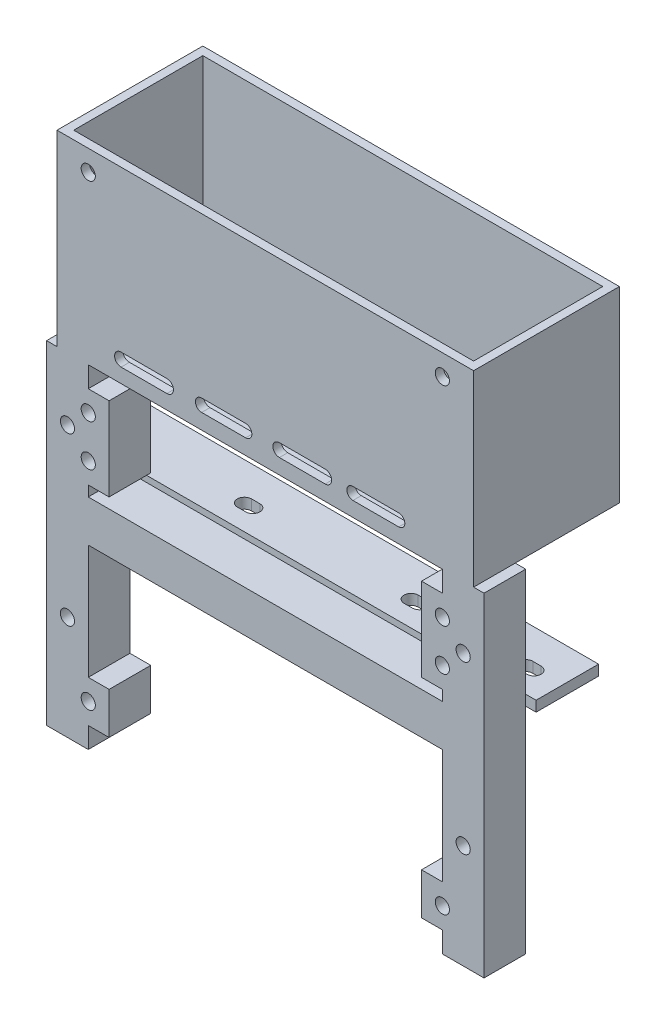
from build123d import *

# Parameters (mm, degrees)
V3_BOX_FOOTPRINT_100_X_45_MM_W                 = 100
V3_BOX_FOOTPRINT_100_X_45_MM_H                 = 45
V3_BOX_HEIGHT_35_MM_DEPTH                      = 35
V3_REAR_OPENING_96_X_31_MM_W                   = 96
V3_REAR_OPENING_96_X_31_MM_H                   = 31
V3_CAVITY_ALL_WALLS_2_MM_DEPTH                 = 43
V3_SQUARE_BEAMS_10_X_10_PITCH_95_MM_W          = 10
V3_SQUARE_BEAMS_10_X_10_PITCH_95_MM_H          = 10
V3_FORWARD_BEAM_LENGTH_65_MM_DEPTH             = 65
V3_LEFT_PCB_EAR_PROFILE_W                      = 10
V3_LEFT_PCB_EAR_PROFILE_H                      = 10
V3_LEFT_INWARD_EAR_5_MM_DEPTH                  = 5
V3_RIGHT_PCB_EAR_PROFILE_W                     = 10
V3_RIGHT_PCB_EAR_PROFILE_H                     = 10
V3_RIGHT_INWARD_EAR_5_MM_DEPTH                 = 5
V3_PCB_ROOF_PAIR_PITCH_85_MM_R                 = 1.7
V3_M3_ROOF_HOLES_DIAMETER_3_4_MM_DEPTH         = 2
V3_PCB_FORWARD_PAIR_ROW_SPACING_60_MM_R        = 1.7
V3_M3_PCB_EAR_HOLES_DEPTH                      = 10
V3_CHASSIS_TOP_HOLES_WIDTH_95_DEPTH_40_M_R     = 1.7
V3_M3_BEAM_TOP_BOTTOM_HOLES_DEPTH              = 10
V3_HANGING_PLATE_OFFSET_26_THICKNESS_2_5_W     = 110
V3_HANGING_PLATE_OFFSET_26_THICKNESS_2_5_H     = 2.5
V3_MOUNTING_PLATE_DOWNWARD_15_MM_WIDTH_1_DEPTH = 15
FOUR_HORIZONTAL_SLOTS_3_4_X_5_4_MM_DEPTH       = 2.5
CUT_EXTRUDE_1_DEPTH                            = 93.059763198
H_CROSSMEMBER_10_X_10_MM_AT_BEAM_MIDPOIN_W     = 10
H_CROSSMEMBER_10_X_10_MM_AT_BEAM_MIDPOIN_H     = 10
H_CROSSMEMBER_85_MM_DEPTH                      = 85
LONGITUDINAL_START                             = -2
BEAM_CAVITIES_6_MM_WIDE_PRESERVING_SCREW_W     = 6
BEAM_CAVITIES_6_MM_WIDE_PRESERVING_SCREW_H     = 6
BEAM_CAVITIES_6_MM_WIDE_PRESERVING_SCREW_H_2   = 27
BEAM_CAVITIES_6_MM_WIDE_PRESERVING_SCREW_H_3   = 9
LONGITUDINAL_BEAM_WALLS_2_MM_INNER_HEI_DEPTH   = 6
H_START                                        = -2
H_CROSSMEMBER_CAVITY_CONNECTS_BOTH_BEAM_W      = 89
H_CROSSMEMBER_CAVITY_CONNECTS_BOTH_BEAM_H      = 6
H_CROSSMEMBER_WALLS_2_MM_DEPTH                 = 6
CUT_EXTRUDE_4_DEPTH                            = 93.059763198
V6_EXTEND_10_X_10_HOLLOW_BEAMS_WITH_2_MM_W     = 10
V6_EXTEND_10_X_10_HOLLOW_BEAMS_WITH_2_MM_H     = 10
V6_EXTEND_10_X_10_HOLLOW_BEAMS_WITH_2_MM_W_2   = 6
V6_EXTEND_10_X_10_HOLLOW_BEAMS_WITH_2_MM_H_2   = 6
V6_HOLLOW_BEAM_EXTENSIONS_15_MM_DEPTH          = 15
V6_FOUR_FULL_DEPTH_PCB_PADS_CENTERS_X42_W      = 15
V6_FOUR_FULL_DEPTH_PCB_PADS_CENTERS_X42_H      = 10
V6_SOLID_SCREW_PADS_WITH_5_MM_INWARD_EAR_DEPTH = 10
V6_PCB_HOLES_85_X_60_MM_AND_RETAINED_CHA_R     = 1.7
V6_FOUR_PCB_M3_HOLES_THROUGH_REINFORCED_DEPTH  = 10


with BuildPart() as part:
    # V3 box footprint 100 x 45 mm → V3 box height 35 mm (new body)
    with BuildSketch(Plane.XY):
        with Locations((0, 22.5)):
            Rectangle(V3_BOX_FOOTPRINT_100_X_45_MM_W, V3_BOX_FOOTPRINT_100_X_45_MM_H)
    extrude(amount=V3_BOX_HEIGHT_35_MM_DEPTH)

    # V3 rear opening 96 x 31 mm → V3 cavity all walls 2 mm (cut)
    with BuildSketch(Plane(origin=(0, 45, 0), x_dir=(1, 0, 0), z_dir=(0, 1, 0))):
        with Locations((0, -17.5)):
            Rectangle(V3_REAR_OPENING_96_X_31_MM_W, V3_REAR_OPENING_96_X_31_MM_H)
    extrude(amount=-V3_CAVITY_ALL_WALLS_2_MM_DEPTH, mode=Mode.SUBTRACT)

    # V3 square beams 10 x 10 pitch 95 mm → V3 forward beam length 65 mm (add)
    with BuildSketch(Plane.XZ):
        with Locations((-47.5, 30)):
            Rectangle(V3_SQUARE_BEAMS_10_X_10_PITCH_95_MM_W, V3_SQUARE_BEAMS_10_X_10_PITCH_95_MM_H)
        with Locations((47.5, 30)):
            Rectangle(V3_SQUARE_BEAMS_10_X_10_PITCH_95_MM_W, V3_SQUARE_BEAMS_10_X_10_PITCH_95_MM_H)
    extrude(amount=V3_FORWARD_BEAM_LENGTH_65_MM_DEPTH)

    # V3 left PCB ear profile → V3 left inward ear 5 mm (add)
    with BuildSketch(Plane(origin=(-42.5, 0, 0), x_dir=(0, 0, -1), z_dir=(1, 0, 0))):
        with Locations((-30, -20)):
            Rectangle(V3_LEFT_PCB_EAR_PROFILE_W, V3_LEFT_PCB_EAR_PROFILE_H)
    extrude(amount=V3_LEFT_INWARD_EAR_5_MM_DEPTH)

    # V3 right PCB ear profile → V3 right inward ear 5 mm (add)
    with BuildSketch(Plane.ZY.offset(-42.5)):
        with Locations((30, -20)):
            Rectangle(V3_RIGHT_PCB_EAR_PROFILE_W, V3_RIGHT_PCB_EAR_PROFILE_H)
    extrude(amount=V3_RIGHT_INWARD_EAR_5_MM_DEPTH)

    # V3 PCB roof pair pitch 85 mm → V3 M3 roof holes diameter 3.4 mm (cut)
    with BuildSketch(Plane.XY.offset(35)):
        with Locations((-42.5, 40)):
            Circle(V3_PCB_ROOF_PAIR_PITCH_85_MM_R)
        with Locations((42.5, 40)):
            Circle(V3_PCB_ROOF_PAIR_PITCH_85_MM_R)
    extrude(amount=-V3_M3_ROOF_HOLES_DIAMETER_3_4_MM_DEPTH, mode=Mode.SUBTRACT)

    # V3 PCB forward pair row spacing 60 mm → V3 M3 PCB ear holes (cut)
    with BuildSketch(Plane.XY.offset(35)):
        with Locations((-42.5, -20)):
            Circle(V3_PCB_FORWARD_PAIR_ROW_SPACING_60_MM_R)
        with Locations((42.5, -20)):
            Circle(V3_PCB_FORWARD_PAIR_ROW_SPACING_60_MM_R)
    extrude(amount=-V3_M3_PCB_EAR_HOLES_DEPTH, mode=Mode.SUBTRACT)

    # V3 chassis top holes width 95 depth 40 mm → V3 M3 beam top bottom holes (cut)
    with BuildSketch(Plane.XY.offset(35)):
        with Locations((-47.5, -55)):
            Circle(V3_CHASSIS_TOP_HOLES_WIDTH_95_DEPTH_40_M_R)
        with Locations((-47.5, -15)):
            Circle(V3_CHASSIS_TOP_HOLES_WIDTH_95_DEPTH_40_M_R)
        with Locations((47.5, -55)):
            Circle(V3_CHASSIS_TOP_HOLES_WIDTH_95_DEPTH_40_M_R)
        with Locations((47.5, -15)):
            Circle(V3_CHASSIS_TOP_HOLES_WIDTH_95_DEPTH_40_M_R)
    extrude(amount=-V3_M3_BEAM_TOP_BOTTOM_HOLES_DEPTH, mode=Mode.SUBTRACT)

    # V3 hanging plate offset 26 thickness 2.5 mm → V3 mounting plate downward 15 mm width 110 (add)
    with BuildSketch(Plane(origin=(0, 0, 25), x_dir=(-1, 0, 0), z_dir=(0, 0, -1))):
        with Locations((0, -27.25)):
            Rectangle(V3_HANGING_PLATE_OFFSET_26_THICKNESS_2_5_W, V3_HANGING_PLATE_OFFSET_26_THICKNESS_2_5_H)
    extrude(amount=V3_MOUNTING_PLATE_DOWNWARD_15_MM_WIDTH_1_DEPTH)

    # V3 slots 6 mm below beam underside centers 20 and 47.5 → Four horizontal slots 3.4 x 5.4 mm (cut)
    with BuildSketch(Plane.XZ.offset(28.5)):
        with BuildLine():
            Line((-48.5, 20.7), (-46.5, 20.7))
            ThreePointArc((-46.5, 20.7), (-44.8, 19), (-46.5, 17.3))
            Line((-46.5, 17.3), (-48.5, 17.3))
            ThreePointArc((-48.5, 17.3), (-50.2, 19), (-48.5, 20.7))
        make_face()
        with BuildLine():
            Line((-21, 20.7), (-19, 20.7))
            ThreePointArc((-19, 20.7), (-17.3, 19), (-19, 17.3))
            Line((-19, 17.3), (-21, 17.3))
            ThreePointArc((-21, 17.3), (-22.7, 19), (-21, 20.7))
        make_face()
        with BuildLine():
            Line((19, 20.7), (21, 20.7))
            ThreePointArc((21, 20.7), (22.7, 19), (21, 17.3))
            Line((21, 17.3), (19, 17.3))
            ThreePointArc((19, 17.3), (17.3, 19), (19, 20.7))
        make_face()
        with BuildLine():
            Line((46.5, 20.7), (48.5, 20.7))
            ThreePointArc((48.5, 20.7), (50.2, 19), (48.5, 17.3))
            Line((48.5, 17.3), (46.5, 17.3))
            ThreePointArc((46.5, 17.3), (44.8, 19), (46.5, 20.7))
        make_face()
    extrude(amount=-FOUR_HORIZONTAL_SLOTS_3_4_X_5_4_MM_DEPTH, mode=Mode.SUBTRACT)

    # 草图2 → 切除-拉伸1 (cut, through all)
    with BuildSketch(Plane(origin=(0, 0, 0), x_dir=(-1, 0, 0), z_dir=(0, 0, -1))):
        with BuildLine():
            Line((-32.029979042, 6.459471041), (-21.029979042, 6.459471041))
            ThreePointArc((-21.029979042, 6.459471041), (-19.570508001, 5), (-21.029979042, 3.540528959))
            Line((-21.029979042, 3.540528959), (-32.029979042, 3.540528959))
            ThreePointArc((-32.029979042, 3.540528959), (-33.489450083, 5), (-32.029979042, 6.459471041))
        make_face()
        with BuildLine():
            Line((23.620107008, 6.558669056), (34.620107008, 6.558669056))
            ThreePointArc((34.620107008, 6.558669056), (36.178776063, 5), (34.620107008, 3.441330944))
            Line((34.620107008, 3.441330944), (23.620107008, 3.441330944))
            ThreePointArc((23.620107008, 3.441330944), (22.061437952, 5), (23.620107008, 6.558669056))
        make_face()
    extrude(amount=-CUT_EXTRUDE_1_DEPTH, mode=Mode.SUBTRACT)

    # H crossmember 10 x 10 mm at beam midpoint → H crossmember 85 mm (add)
    with BuildSketch(Plane(origin=(-42.5, 0, 0), x_dir=(0, 0, -1), z_dir=(1, 0, 0))):
        with Locations((-30, -32.5)):
            Rectangle(H_CROSSMEMBER_10_X_10_MM_AT_BEAM_MIDPOIN_W, H_CROSSMEMBER_10_X_10_MM_AT_BEAM_MIDPOIN_H)
    extrude(amount=H_CROSSMEMBER_85_MM_DEPTH)

    # Beam cavities 6 mm wide preserving screw collars → Longitudinal beam walls 2 mm - inner height 6 mm (cut)
    with BuildSketch(Plane.XY.offset(35).offset(LONGITUDINAL_START)):
        with Locations((-47.5, -62)):
            Rectangle(BEAM_CAVITIES_6_MM_WIDE_PRESERVING_SCREW_W, BEAM_CAVITIES_6_MM_WIDE_PRESERVING_SCREW_H)
        with Locations((-47.5, -37.5)):
            Rectangle(BEAM_CAVITIES_6_MM_WIDE_PRESERVING_SCREW_W, BEAM_CAVITIES_6_MM_WIDE_PRESERVING_SCREW_H_2)
        with Locations((-47.5, -6.5)):
            Rectangle(BEAM_CAVITIES_6_MM_WIDE_PRESERVING_SCREW_W, BEAM_CAVITIES_6_MM_WIDE_PRESERVING_SCREW_H_3)
        with Locations((47.5, -62)):
            Rectangle(BEAM_CAVITIES_6_MM_WIDE_PRESERVING_SCREW_W, BEAM_CAVITIES_6_MM_WIDE_PRESERVING_SCREW_H)
        with Locations((47.5, -37.5)):
            Rectangle(BEAM_CAVITIES_6_MM_WIDE_PRESERVING_SCREW_W, BEAM_CAVITIES_6_MM_WIDE_PRESERVING_SCREW_H_2)
        with Locations((47.5, -6.5)):
            Rectangle(BEAM_CAVITIES_6_MM_WIDE_PRESERVING_SCREW_W, BEAM_CAVITIES_6_MM_WIDE_PRESERVING_SCREW_H_3)
    extrude(amount=-LONGITUDINAL_BEAM_WALLS_2_MM_INNER_HEI_DEPTH, mode=Mode.SUBTRACT)

    # H crossmember cavity connects both beam cavities → H crossmember walls 2 mm (cut)
    with BuildSketch(Plane.XY.offset(35).offset(H_START)):
        with Locations((0, -32.5)):
            Rectangle(H_CROSSMEMBER_CAVITY_CONNECTS_BOTH_BEAM_W, H_CROSSMEMBER_CAVITY_CONNECTS_BOTH_BEAM_H)
    extrude(amount=-H_CROSSMEMBER_WALLS_2_MM_DEPTH, mode=Mode.SUBTRACT)

    # 草图8 → 切除-拉伸4 (cut, through all)
    with BuildSketch(Plane(origin=(0, 0, 0), x_dir=(-1, 0, 0), z_dir=(0, 0, -1))):
        with BuildLine():
            Line((-14.372732488, 6.733005515), (-3.372732488, 6.733005515))
            ThreePointArc((-3.372732488, 6.733005515), (-1.826093217, 5.186366244), (-3.372732488, 3.639726973))
            Line((-3.372732488, 3.639726973), (-14.372732488, 3.639726973))
            ThreePointArc((-14.372732488, 3.639726973), (-15.919371759, 5.186366244), (-14.372732488, 6.733005515))
        make_face()
        with BuildLine():
            Line((4.72350579, 6.686366244), (15.27649421, 6.686366244))
            ThreePointArc((15.27649421, 6.686366244), (16.77649421, 5.186366244), (15.27649421, 3.686366244))
            Line((15.27649421, 3.686366244), (4.72350579, 3.686366244))
            ThreePointArc((4.72350579, 3.686366244), (3.22350579, 5.186366244), (4.72350579, 6.686366244))
        make_face()
    extrude(amount=-CUT_EXTRUDE_4_DEPTH, mode=Mode.SUBTRACT)

    # V6 extend 10 x 10 hollow beams with 2 mm walls → V6 hollow beam extensions 15 mm (add)
    # profile 1 of 2: a face of its own
    with BuildSketch(Plane.XZ.offset(65)):
        with Locations((-47.5, 30)):
            Rectangle(V6_EXTEND_10_X_10_HOLLOW_BEAMS_WITH_2_MM_W, V6_EXTEND_10_X_10_HOLLOW_BEAMS_WITH_2_MM_H)
        with Locations((-47.5, 30)):
            Rectangle(V6_EXTEND_10_X_10_HOLLOW_BEAMS_WITH_2_MM_W_2, V6_EXTEND_10_X_10_HOLLOW_BEAMS_WITH_2_MM_H_2, mode=Mode.SUBTRACT)
    # profile 2 of 2: a face of its own
    with BuildSketch(Plane.XZ.offset(65)):
        with Locations((47.5, 30)):
            Rectangle(V6_EXTEND_10_X_10_HOLLOW_BEAMS_WITH_2_MM_W, V6_EXTEND_10_X_10_HOLLOW_BEAMS_WITH_2_MM_H)
        with Locations((47.5, 30)):
            Rectangle(V6_EXTEND_10_X_10_HOLLOW_BEAMS_WITH_2_MM_W_2, V6_EXTEND_10_X_10_HOLLOW_BEAMS_WITH_2_MM_H_2, mode=Mode.SUBTRACT)
    extrude(amount=V6_HOLLOW_BEAM_EXTENSIONS_15_MM_DEPTH)

    # V6 four full-depth PCB pads centers x42.5 y-70 and -10 → V6 solid screw pads with 5 mm inward ears (add)
    with BuildSketch(Plane.XY.offset(35)):
        with Locations((-45, -70)):
            Rectangle(V6_FOUR_FULL_DEPTH_PCB_PADS_CENTERS_X42_W, V6_FOUR_FULL_DEPTH_PCB_PADS_CENTERS_X42_H)
        with Locations((45, -70)):
            Rectangle(V6_FOUR_FULL_DEPTH_PCB_PADS_CENTERS_X42_W, V6_FOUR_FULL_DEPTH_PCB_PADS_CENTERS_X42_H)
        with Locations((-45, -10)):
            Rectangle(V6_FOUR_FULL_DEPTH_PCB_PADS_CENTERS_X42_W, V6_FOUR_FULL_DEPTH_PCB_PADS_CENTERS_X42_H)
        with Locations((45, -10)):
            Rectangle(V6_FOUR_FULL_DEPTH_PCB_PADS_CENTERS_X42_W, V6_FOUR_FULL_DEPTH_PCB_PADS_CENTERS_X42_H)
    extrude(amount=-V6_SOLID_SCREW_PADS_WITH_5_MM_INWARD_EAR_DEPTH)

    # V6 PCB holes 85 x 60 mm and retained chassis holes → V6 four PCB M3 holes through reinforced beam pads (cut)
    with BuildSketch(Plane.XY.offset(35)):
        with Locations((-42.5, -70)):
            Circle(V6_PCB_HOLES_85_X_60_MM_AND_RETAINED_CHA_R)
        with Locations((-42.5, -10)):
            Circle(V6_PCB_HOLES_85_X_60_MM_AND_RETAINED_CHA_R)
        with Locations((42.5, -70)):
            Circle(V6_PCB_HOLES_85_X_60_MM_AND_RETAINED_CHA_R)
        with Locations((42.5, -10)):
            Circle(V6_PCB_HOLES_85_X_60_MM_AND_RETAINED_CHA_R)
        with Locations((-47.5, -15)):
            Circle(V6_PCB_HOLES_85_X_60_MM_AND_RETAINED_CHA_R)
        with Locations((47.5, -15)):
            Circle(V6_PCB_HOLES_85_X_60_MM_AND_RETAINED_CHA_R)
    extrude(amount=-V6_FOUR_PCB_M3_HOLES_THROUGH_REINFORCED_DEPTH, mode=Mode.SUBTRACT)


solid = part.part
